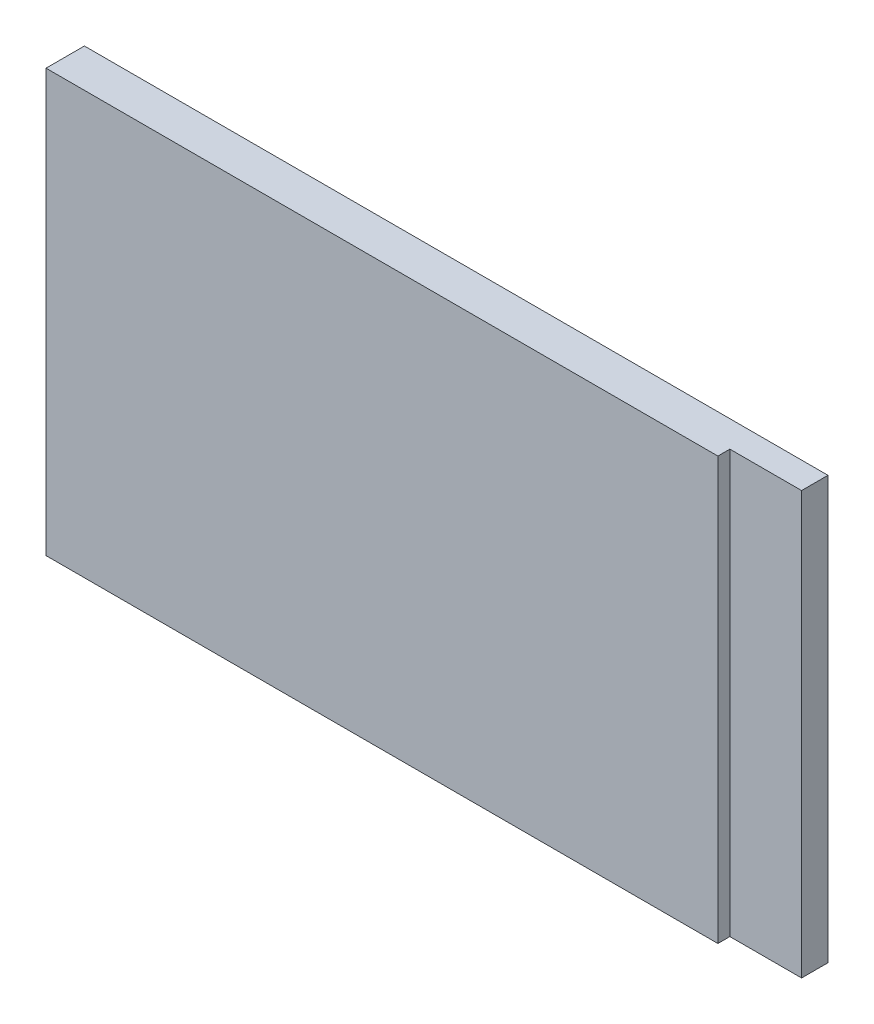
from build123d import *

# Parameters (mm, degrees)
SKETCH_1_W          = 31
SKETCH_1_H          = 17.6
EXTRUDE_1_DEPTH     = 1.6
SKETCH_2_W          = 2.99
SKETCH_2_H          = 17.6
CUT_EXTRUDE_1_DEPTH = 0.5


with BuildPart() as part:
    # 草图1 → 凸台-拉伸1 (new body)
    with BuildSketch(Plane.XY):
        Rectangle(SKETCH_1_W, SKETCH_1_H)
    extrude(amount=EXTRUDE_1_DEPTH)

    # 草图2 → 切除-拉伸1 (cut)
    with BuildSketch(Plane.XY.offset(1.6)):
        with Locations((14.005, 0)):
            Rectangle(SKETCH_2_W, SKETCH_2_H)
    extrude(amount=-CUT_EXTRUDE_1_DEPTH, mode=Mode.SUBTRACT)


solid = part.part
